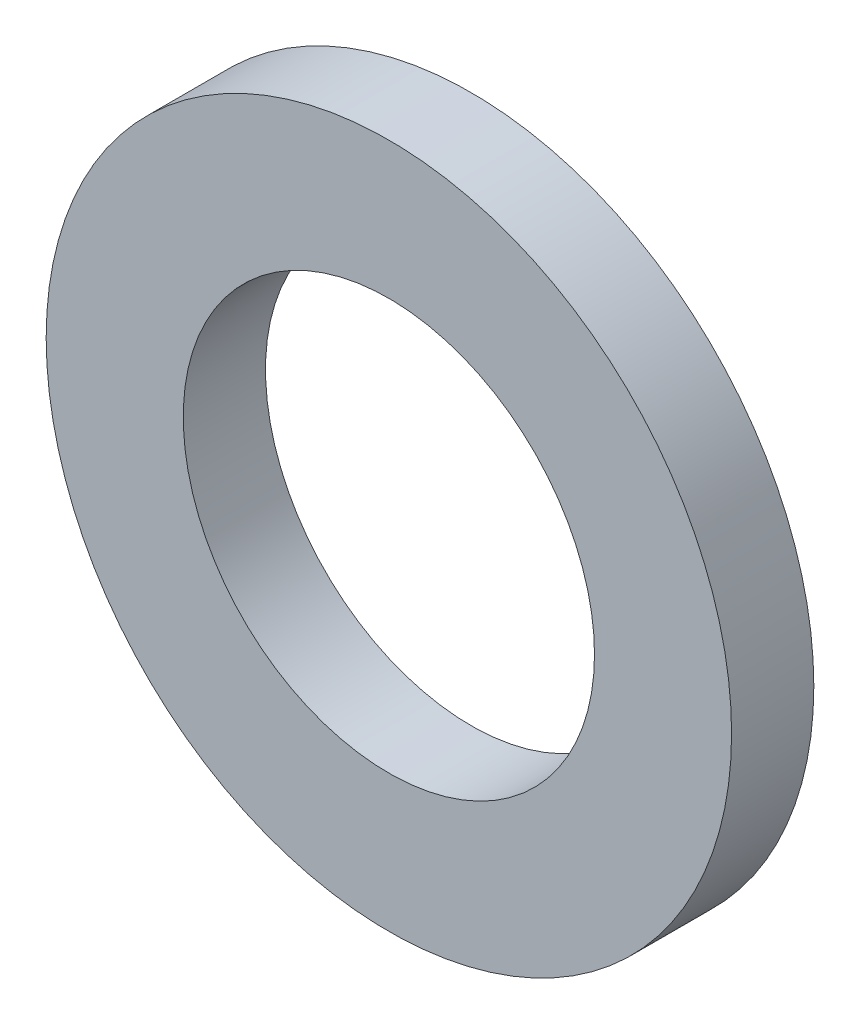
from build123d import *

# Parameters (mm, degrees)
SKETCH_1_R      = 12.5
SKETCH_1_R_2    = 7.5
EXTRUDE_1_DEPTH = 3


with BuildPart() as part:
    # 스케치1 → 보스-돌출1 (new body)
    with BuildSketch(Plane.XY):
        Circle(SKETCH_1_R)
        Circle(SKETCH_1_R_2, mode=Mode.SUBTRACT)
    extrude(amount=EXTRUDE_1_DEPTH)


solid = part.part
